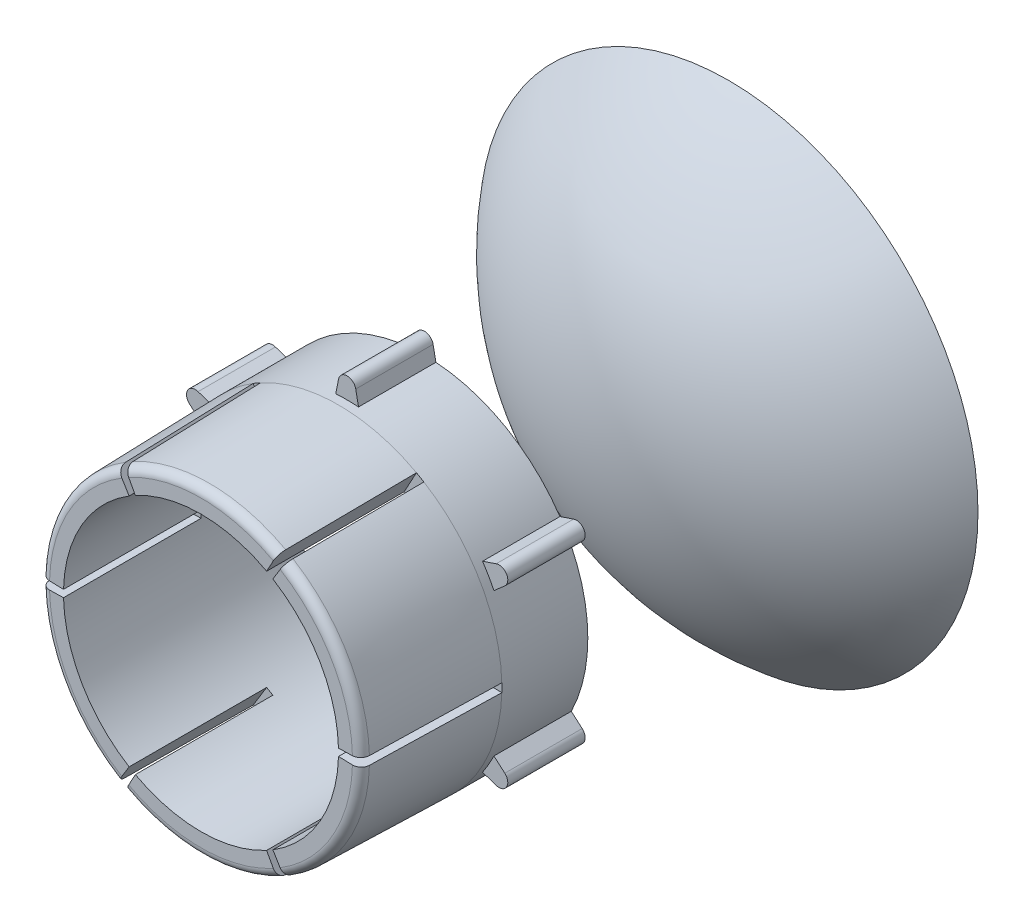
from build123d import *

# Parameters (mm, degrees)
SKETCH1_R           = 9.5
SKETCH1_R_2         = 8
BOSS_EXTRUDE1_DEPTH = 13
CUT_EXTRUDE1_START  = -8
CUT_EXTRUDE1_DEPTH  = 8
FILLET1_R           = 0.5
BOSS_EXTRUDE2_DEPTH = 4.5
SKETCH9_R           = 7.9
CUT_EXTRUDE3_DEPTH  = 1


with BuildPart() as part:
    # Sketch1 → Boss-Extrude1 (new body)
    with BuildSketch(Plane.XY):
        with Locations(Location((0, 0, 0), (0, 0, 180))):
            Circle(SKETCH1_R)
        with Locations(Location((0, 0, 0), (0, 0, 180))):
            Circle(SKETCH1_R_2, mode=Mode.SUBTRACT)
    extrude(amount=BOSS_EXTRUDE1_DEPTH)

    # Cut-Sweep1: sweep along a path in Sketch3
    with BuildLine(Plane.XY.offset(13)) as cut_sweep1_path:
        CenterArc((0, 0), 9.3, 0, 360)
    # Sketch2 → Cut-Sweep1 (sweep, cut)
    with BuildSketch(Plane(origin=(0, 0, 0), x_dir=(1, 0, 0), z_dir=(0, 1, 0))):
        Polygon((9.5, -13), (9.5, -5), (9.3, -13), align=None)
    sweep(path=cut_sweep1_path.line, mode=Mode.SUBTRACT)

    # Sketch4 → Cut-Extrude1 (cut)
    with BuildSketch(Plane.XY.offset(13).offset(CUT_EXTRUDE1_START)):
        with BuildLine():
            Line((-10.4972586, -0.27488039), (-7.9972586, -0.209415586))
            ThreePointArc((-7.9972586, -0.209415586), (-8, 0), (-7.9972586, 0.209415586))
            Line((-7.9972586, 0.209415586), (-10.4972586, 0.27488039))
            ThreePointArc((-10.4972586, 0.27488039), (-10.500856981, 0), (-10.4972586, -0.27488039))
        make_face()
        with BuildLine():
            Line((-5.486682701, 8.953452422), (-4.179988518, 6.821121315))
            ThreePointArc((-4.179988518, 6.821121315), (-4, 6.92820323), (-3.817270082, 7.030536901))
            Line((-3.817270082, 7.030536901), (-5.010575899, 9.228332813))
            ThreePointArc((-5.010575899, 9.228332813), (-5.250428491, 9.094008907), (-5.486682701, 8.953452422))
        make_face()
        with BuildLine():
            Line((5.010575899, 9.228332813), (3.817270082, 7.030536901))
            ThreePointArc((3.817270082, 7.030536901), (4, 6.92820323), (4.179988518, 6.821121315))
            Line((4.179988518, 6.821121315), (5.486682701, 8.953452422))
            ThreePointArc((5.486682701, 8.953452422), (5.250428491, 9.094008907), (5.010575899, 9.228332813))
        make_face()
        with BuildLine():
            Line((10.4972586, 0.27488039), (7.9972586, 0.209415586))
            ThreePointArc((7.9972586, 0.209415586), (8, 0), (7.9972586, -0.209415586))
            Line((7.9972586, -0.209415586), (10.4972586, -0.27488039))
            ThreePointArc((10.4972586, -0.27488039), (10.500856981, 0), (10.4972586, 0.27488039))
        make_face()
        with BuildLine():
            Line((5.486682701, -8.953452422), (4.179988518, -6.821121315))
            ThreePointArc((4.179988518, -6.821121315), (4, -6.92820323), (3.817270082, -7.030536901))
            Line((3.817270082, -7.030536901), (5.010575899, -9.228332813))
            ThreePointArc((5.010575899, -9.228332813), (5.250428491, -9.094008907), (5.486682701, -8.953452422))
        make_face()
        with BuildLine():
            Line((-5.010575899, -9.228332813), (-3.817270082, -7.030536901))
            ThreePointArc((-3.817270082, -7.030536901), (-4, -6.92820323), (-4.179988518, -6.821121315))
            Line((-4.179988518, -6.821121315), (-5.486682701, -8.953452422))
            ThreePointArc((-5.486682701, -8.953452422), (-5.250428491, -9.094008907), (-5.010575899, -9.228332813))
        make_face()
    extrude(amount=CUT_EXTRUDE1_DEPTH, mode=Mode.SUBTRACT)

    # Fillet1
    fillet1_edges = [part.edges().sort_by_distance(p)[0] for p in [
        (8.054036255, 4.65, 13),
        (0, 9.3, 13),
        (-8.054036255, 4.65, 13),
        (-8.054036255, -4.65, 13),
        (0, -9.3, 13),
        (8.054036255, -4.65, 13),
    ]]
    fillet(fillet1_edges, radius=FILLET1_R)

    # Sketch8 → Boss-Extrude2 (add)
    with BuildSketch(Plane(origin=(0, 0, 0), x_dir=(-1, 0, 0), z_dir=(0, 0, -1))):
        with BuildLine():
            Line((-0.662686501, 9.476858477), (-0.5, 10.3))
            ThreePointArc((-0.5, 10.3), (0, 10.710851451), (0.5, 10.3))
            Line((0.5, 10.3), (0.662686501, 9.476858477))
            ThreePointArc((0.662686501, 9.476858477), (0, 9.5), (-0.662686501, 9.476858477))
        make_face()
        with BuildLine():
            Line((9.170061659, 4.716987298), (8.53854344, 4.164525894))
            ThreePointArc((8.53854344, 4.164525894), (8.227241336, 4.75), (7.875856939, 5.312332583))
            Line((7.875856939, 5.312332583), (8.670061659, 5.583012702))
            ThreePointArc((8.670061659, 5.583012702), (9.275869453, 5.355425726), (9.170061659, 4.716987298))
        make_face()
        with BuildLine():
            Line((8.670061659, -5.583012702), (7.875856939, -5.312332583))
            ThreePointArc((7.875856939, -5.312332583), (8.227241336, -4.75), (8.53854344, -4.164525894))
            Line((8.53854344, -4.164525894), (9.170061659, -4.716987298))
            ThreePointArc((9.170061659, -4.716987298), (9.275869453, -5.355425726), (8.670061659, -5.583012702))
        make_face()
        with BuildLine():
            Line((-0.5, -10.3), (-0.662686501, -9.476858477))
            ThreePointArc((-0.662686501, -9.476858477), (0, -9.5), (0.662686501, -9.476858477))
            Line((0.662686501, -9.476858477), (0.5, -10.3))
            ThreePointArc((0.5, -10.3), (0, -10.710851451), (-0.5, -10.3))
        make_face()
        with BuildLine():
            Line((-9.170061659, -4.716987298), (-8.53854344, -4.164525894))
            ThreePointArc((-8.53854344, -4.164525894), (-8.227241336, -4.75), (-7.875856939, -5.312332583))
            Line((-7.875856939, -5.312332583), (-8.670061659, -5.583012702))
            ThreePointArc((-8.670061659, -5.583012702), (-9.275869453, -5.355425726), (-9.170061659, -4.716987298))
        make_face()
        with BuildLine():
            Line((-8.670061659, 5.583012702), (-7.875856939, 5.312332583))
            ThreePointArc((-7.875856939, 5.312332583), (-8.227241336, 4.75), (-8.53854344, 4.164525894))
            Line((-8.53854344, 4.164525894), (-9.170061659, 4.716987298))
            ThreePointArc((-9.170061659, 4.716987298), (-9.275869453, 5.355425726), (-8.670061659, 5.583012702))
        make_face()
    extrude(amount=-BOSS_EXTRUDE2_DEPTH)


with BuildPart() as body_2:
    # Sketch6 → Revolve1 (revolve)
    with BuildSketch(Plane(origin=(0, 0, 0), x_dir=(1, 0, 0), z_dir=(0, 1, 0)), mode=Mode.PRIVATE) as revolve1_sk:
        with BuildLine():
            Line((0, 17.69394043), (14.5, 17.69394043))
            ThreePointArc((14.5, 17.69394043), (8.050621094, 12.535511021), (0, 10.69394043))
            Line((0, 10.69394043), (0, 17.69394043))
        make_face()
    revolve(revolve1_sk.sketch.rotate(Axis((0, 0, -17.69394043), (0, 0, 1)), 181.5), axis=Axis((0, 0, -17.69394043), (0, 0, 1)))

    # Sketch9 → Cut-Extrude3 (cut)
    with BuildSketch(Plane(origin=(0, 0, -17.69394043), x_dir=(-1, 0, 0), z_dir=(0, 0, -1))):
        with BuildLine():
            Line((0.746020737, 9.570969285), (0.59810232, 10.319389039))
            ThreePointArc((0.59810232, 10.319389039), (0, 10.810851451), (-0.59810232, 10.319389039))
            Line((-0.59810232, 10.319389039), (-0.746020737, 9.570969285))
            ThreePointArc((-0.746020737, 9.570969285), (-4.8, 8.313843876), (-7.915692172, 5.431557552))
            Line((-7.915692172, 5.431557552), (-8.637801899, 5.677666323))
            ThreePointArc((-8.637801899, 5.677666323), (-9.362471993, 5.405425726), (-9.235904219, 4.641722716))
            Line((-9.235904219, 4.641722716), (-8.661712908, 4.139411733))
            ThreePointArc((-8.661712908, 4.139411733), (-9.6, 0), (-8.661712908, -4.139411733))
            Line((-8.661712908, -4.139411733), (-9.235904219, -4.641722716))
            ThreePointArc((-9.235904219, -4.641722716), (-9.362471993, -5.405425726), (-8.637801899, -5.677666323))
            Line((-8.637801899, -5.677666323), (-7.915692172, -5.431557552))
            ThreePointArc((-7.915692172, -5.431557552), (-4.8, -8.313843876), (-0.746020737, -9.570969285))
            Line((-0.746020737, -9.570969285), (-0.59810232, -10.319389039))
            ThreePointArc((-0.59810232, -10.319389039), (0, -10.810851451), (0.59810232, -10.319389039))
            Line((0.59810232, -10.319389039), (0.746020737, -9.570969285))
            ThreePointArc((0.746020737, -9.570969285), (4.8, -8.313843876), (7.915692172, -5.431557552))
            Line((7.915692172, -5.431557552), (8.637801899, -5.677666323))
            ThreePointArc((8.637801899, -5.677666323), (9.362471993, -5.405425726), (9.235904219, -4.641722716))
            Line((9.235904219, -4.641722716), (8.661712908, -4.139411733))
            ThreePointArc((8.661712908, -4.139411733), (9.6, 0), (8.661712908, 4.139411733))
            Line((8.661712908, 4.139411733), (9.235904219, 4.641722716))
            ThreePointArc((9.235904219, 4.641722716), (9.362471993, 5.405425726), (8.637801899, 5.677666323))
            Line((8.637801899, 5.677666323), (7.915692172, 5.431557552))
            ThreePointArc((7.915692172, 5.431557552), (4.8, 8.313843876), (0.746020737, 9.570969285))
        make_face()
        Circle(SKETCH9_R, mode=Mode.SUBTRACT)
    extrude(amount=-CUT_EXTRUDE3_DEPTH, mode=Mode.SUBTRACT)


solid = Compound([part.part, body_2.part])
